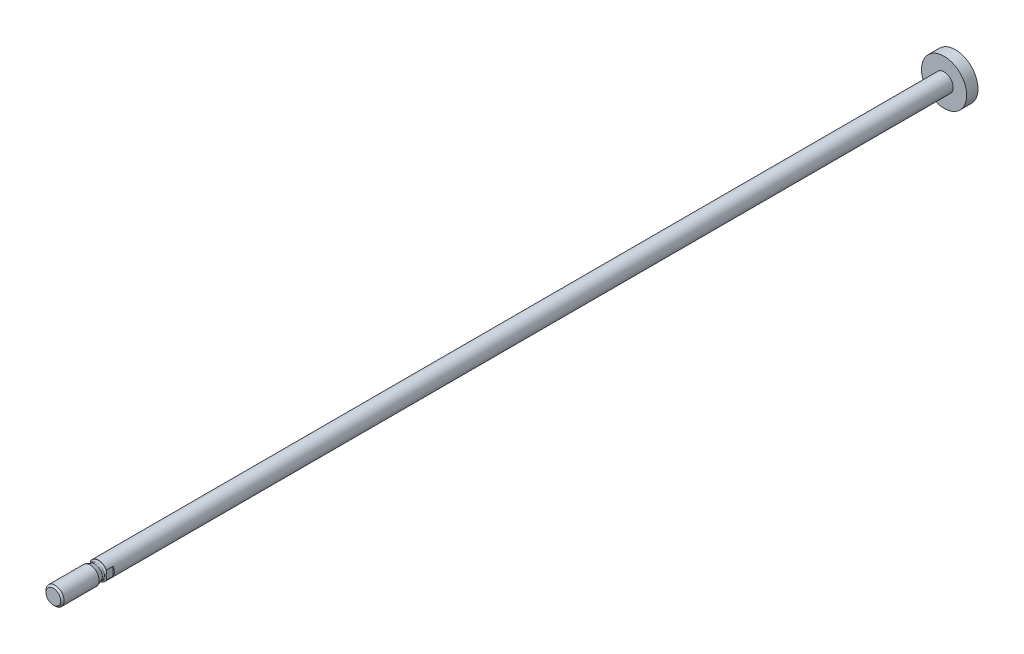
from build123d import *

# Parameters (mm, degrees)
SCHNITT_LINEAR_AUSTRAGEN1_DEPTH = 4


with BuildPart() as part:
    # Skizze1 → Rotation1 (revolve)
    with BuildSketch(Plane(origin=(0, 0, 0), x_dir=(0, 0, -1), z_dir=(1, 0, 0))):
        Polygon((-4, 0), (-4, 4), (370.3, 4), (370.3, 10), (375.3, 10), (375.3, 0), align=None)
    revolve(axis=Axis((0, 0, -375.3), (0, 0, 1)))

    # Skizze2 → Rotation2 (revolve)
    with BuildSketch(Plane(origin=(0, 0, 0), x_dir=(0, 0, -1), z_dir=(1, 0, 0))):
        with BuildLine():
            Line((-24, 0), (-24, 3.233))
            Line((-24, 3.233), (-23.233, 4))
            Line((-23.233, 4), (-7.697981936, 4))
            Line((-7.697981936, 4), (-5.599415898, 3.236184428))
            ThreePointArc((-5.599415898, 3.236184428), (-5.498392718, 3.209115348), (-5.394203812, 3.2))
            Line((-5.394203812, 3.2), (-4.6, 3.2))
            ThreePointArc((-4.6, 3.2), (-4.175735931, 3.375735931), (-4, 3.8))
            Line((-4, 3.8), (-4, 4))
            Line((-4, 4), (-3, 4))
            Line((-3, 4), (-3, 0))
            Line((-3, 0), (-24, 0))
        make_face()
    revolve(axis=Axis((0, 0, 3), (0, 0, 1)))

    # Skizze3 → Schnitt-Linear austragen1 (cut)
    with BuildSketch(Plane.XY.offset(1)):
        Polygon((-7, 14), (-7, -7), (-3.5, -7), (-3.5, 7), (3.5, 7), (3.5, -7), (7, -7), (7, 14), align=None)
    extrude(amount=SCHNITT_LINEAR_AUSTRAGEN1_DEPTH, mode=Mode.SUBTRACT)


solid = part.part
